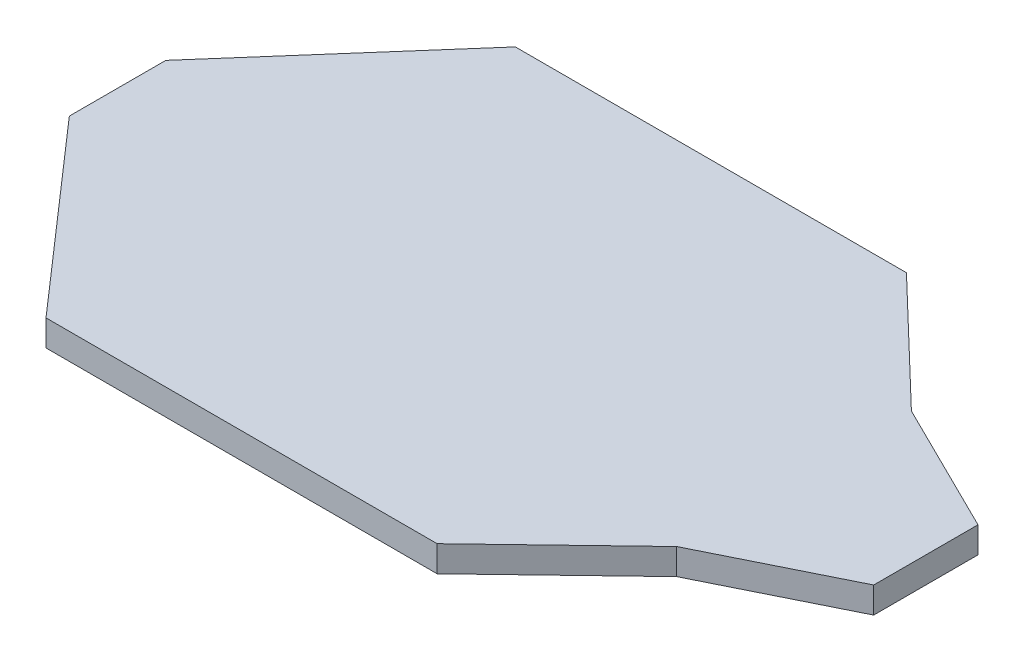
from build123d import *

# Parameters (mm, degrees)
BOSS_EXTRUDE1_DEPTH = 10


with BuildPart() as part:
    # Sketch2 → Boss-Extrude1 (new body)
    with BuildSketch(Plane(origin=(0, 0, 0), x_dir=(1, 0, 0), z_dir=(0, 1, 0))):
        Polygon((310, -20), (310, 20), (259.456135984, 45), (212.551978386, 90), (62.551978386, 90), (0, 18.5), (0, -18.5), (62.551978386, -90), (212.551978386, -90), (259.456135984, -45), align=None)
    extrude(amount=BOSS_EXTRUDE1_DEPTH)


solid = part.part
